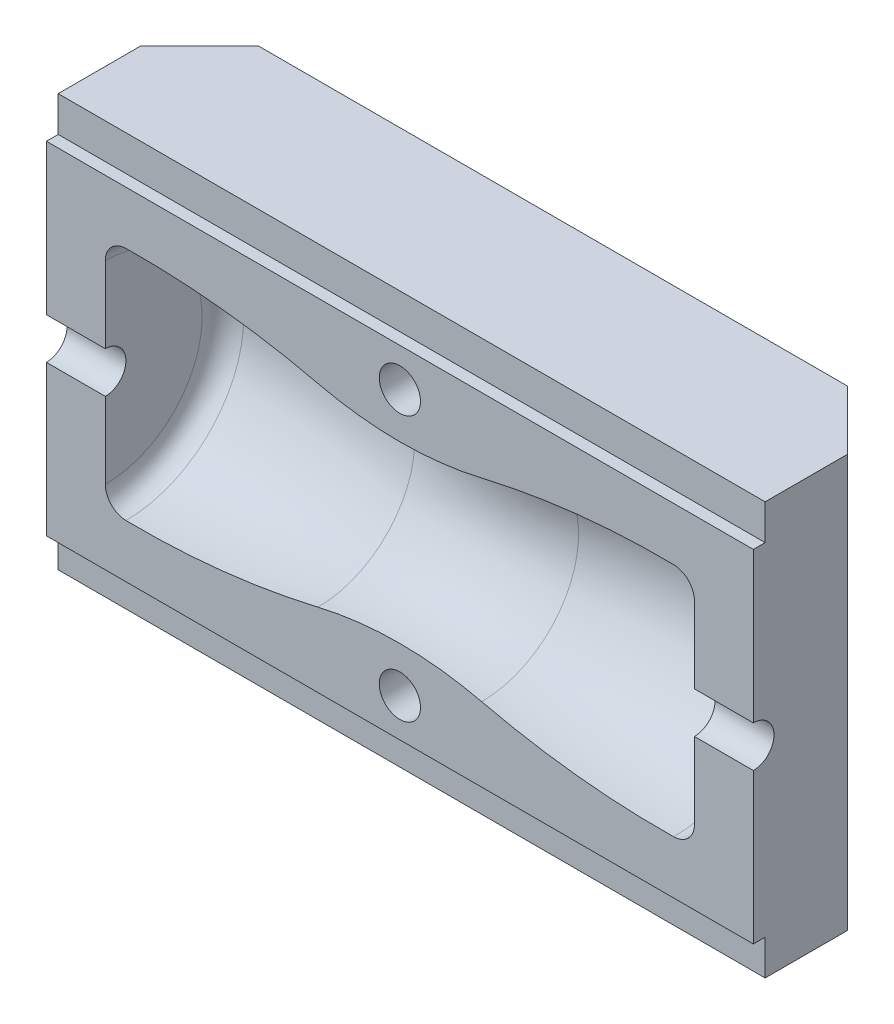
from build123d import *

# Parameters (mm, degrees)
SKETCH1_W               = 60
SKETCH1_H               = 35
BOSS_EXTRUDE1_DEPTH     = 13
CUT_EXTRUDE1_DEPTH      = 64.837684937
CUT_EXTRUDE1_DEPTH_BACK = 64.837684937
SKETCH3_R               = 1.75
SKETCH4_W               = 60
SKETCH4_H               = 3
CUT_EXTRUDE2_DEPTH      = 1
SKETCH5_R               = 1.75
CUT_EXTRUDE3_DEPTH      = 38.084363362
CHAMFER1_SIZE           = 5
SKETCH6_R               = 3.75
CUT_EXTRUDE4_DEPTH      = 7
CHAMFER2_SIZE           = 0.5


with BuildPart() as part:
    # Sketch1 → Boss-Extrude1 (new body)
    with BuildSketch(Plane.XY):
        Rectangle(SKETCH1_W, SKETCH1_H)
    extrude(amount=BOSS_EXTRUDE1_DEPTH)

    # Sketch2 → Cut-Revolve1 (revolve, cut)
    with BuildSketch(Plane.XY.offset(13)):
        with BuildLine():
            Line((-25, 0), (-25, 8.218127455))
            ThreePointArc((-25, 8.218127455), (-24.486963528, 9.469250598), (-23.243251097, 10))
            ThreePointArc((-23.243251097, 10), (-15.040879193, 9.611248064), (-6.94833646, 8.218127455))
            ThreePointArc((-6.94833646, 8.218127455), (0, 7.408356031), (6.94833646, 8.218127455))
            ThreePointArc((6.94833646, 8.218127455), (15.040879193, 9.611248064), (23.243251097, 10))
            ThreePointArc((23.243251097, 10), (24.486963528, 9.469250598), (25, 8.218127455))
            Line((25, 8.218127455), (25, 0))
            Line((25, 0), (-25, 0))
        make_face()
    revolve(axis=Axis((25, 0, 13), (-1, 0, 0)), mode=Mode.SUBTRACT)

    # Sketch3 → Cut-Extrude1 (cut, two sides: drawn at the far end of the back side and taken through both)
    with BuildSketch(Plane(origin=(30, 0, 0), x_dir=(0, 0, -1), z_dir=(1, 0, 0)).offset(-CUT_EXTRUDE1_DEPTH_BACK)):
        with Locations((-13, 0)):
            Circle(SKETCH3_R)
    extrude(amount=CUT_EXTRUDE1_DEPTH + CUT_EXTRUDE1_DEPTH_BACK, mode=Mode.SUBTRACT)

    # Sketch4 → Cut-Extrude2 (cut)
    with BuildSketch(Plane.XY.offset(13)):
        with Locations((0, 16)):
            Rectangle(SKETCH4_W, SKETCH4_H)
        with Locations((0, -16)):
            Rectangle(SKETCH4_W, SKETCH4_H)
    extrude(amount=-CUT_EXTRUDE2_DEPTH, mode=Mode.SUBTRACT)

    # Sketch5 → Cut-Extrude3 (cut, through all)
    with BuildSketch(Plane.XY.offset(13)):
        with Locations((0, 11.25)):
            Circle(SKETCH5_R)
        with Locations((0, -11.25)):
            Circle(SKETCH5_R)
    extrude(amount=-CUT_EXTRUDE3_DEPTH, mode=Mode.SUBTRACT)

    # Chamfer1
    chamfer1_edges = [part.edges().sort_by_distance(p)[0] for p in [
        (-30, 0, 0),
        (30, 0, 0),
    ]]
    chamfer(chamfer1_edges, length=CHAMFER1_SIZE)

    # Sketch6 → Cut-Extrude4 (cut)
    with BuildSketch(Plane(origin=(0, 0, 0), x_dir=(-1, 0, 0), z_dir=(0, 0, -1))):
        with Locations((0, 11.25)):
            Circle(SKETCH6_R)
        with Locations((0, -11.25)):
            Circle(SKETCH6_R)
    extrude(amount=-CUT_EXTRUDE4_DEPTH, mode=Mode.SUBTRACT)

    # Chamfer2
    chamfer2_edges = [part.edges().sort_by_distance(p)[0] for p in [
        (3.75, -11.25, 0),
        (3.75, -11.25, 7),
        (-1.75, -11.25, 7),
        (3.75, 11.25, 0),
        (3.75, 11.25, 7),
        (-1.75, 11.25, 7),
    ]]
    chamfer(chamfer2_edges, length=CHAMFER2_SIZE)


solid = part.part
